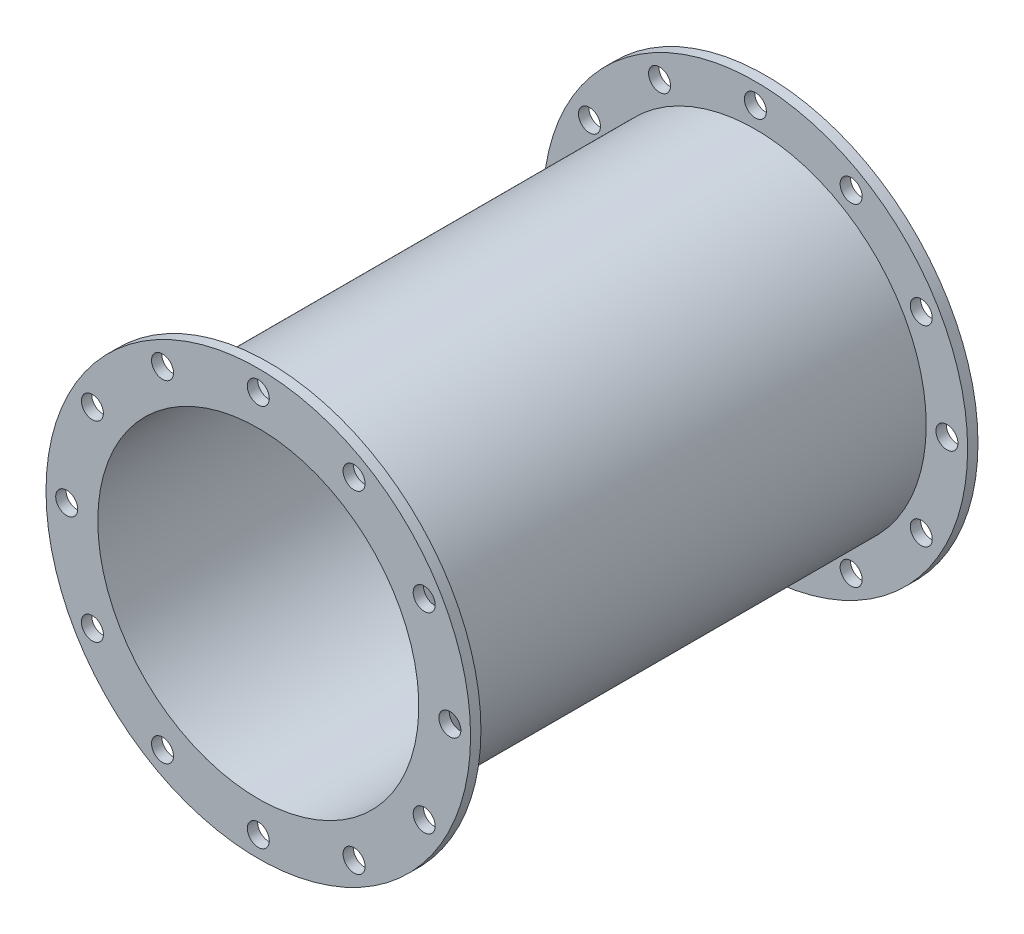
from build123d import *

# Parameters (mm, degrees)
SKETCH2_R               = 104.775
SKETCH2_R_2             = 98.425
BOSS_EXTRUDE1_DEPTH     = 304.8
SKETCH3_R               = 130.175
SKETCH3_R_2             = 104.775
BOSS_EXTRUDE3_DEPTH     = 6.35
F_1_2_CLEARANCE_HOLE1_D = 13.49248
CIRPATTERN1_COUNT       = 12
MIRROR2_COPY_1_D        = 13.49248
MIRROR2_COPY_2_D        = 13.49248
MIRROR2_COPY_3_D        = 13.49248
MIRROR2_COPY_4_D        = 13.49248
MIRROR2_COPY_5_D        = 13.49248
MIRROR2_COPY_6_D        = 13.49248
MIRROR2_COPY_7_D        = 13.49248
MIRROR2_COPY_8_D        = 13.49248
MIRROR2_COPY_9_D        = 13.49248
MIRROR2_COPY_10_D       = 13.49248
MIRROR2_COPY_11_D       = 13.49248


with BuildPart() as part:
    # Sketch2 → Boss-Extrude1 (new body)
    with BuildSketch(Plane.XY):
        with Locations(Location((0, 0, 0), (0, 0, 180))):
            Circle(SKETCH2_R)
        with Locations(Location((0, 0, 0), (0, 0, 180))):
            Circle(SKETCH2_R_2, mode=Mode.SUBTRACT)
    boss_extrude1 = extrude(amount=BOSS_EXTRUDE1_DEPTH)

    # Sketch3 → Boss-Extrude3 (add)
    with BuildSketch(Plane(origin=(0, 0, 0), x_dir=(-1, 0, 0), z_dir=(0, 0, -1))):
        Circle(SKETCH3_R)
        Circle(SKETCH3_R_2, mode=Mode.SUBTRACT)
    boss_extrude3 = extrude(amount=-BOSS_EXTRUDE3_DEPTH)

    # 1/2 Clearance Hole1 (through all)
    with Locations(Plane(origin=(0, 0, 0), x_dir=(-1, 0, 0), z_dir=(0, 0, -1))):
        with Locations((0, 117.475)):
            f_1_2_clearance_hole1 = Hole(F_1_2_CLEARANCE_HOLE1_D / 2)

    # CirPattern1: 1/2 Clearance Hole1 ×12 about axis
    cirpattern1_axis = Axis((0, 0, 0), (0, 0, 1))
    for i in range(1, CIRPATTERN1_COUNT):
        add(f_1_2_clearance_hole1.rotate(cirpattern1_axis, i * 360 / CIRPATTERN1_COUNT), mode=Mode.SUBTRACT)

    # Mirror2: Boss-Extrude1, Boss-Extrude3, 1/2 Clearance Hole1 across plane
    add(boss_extrude1.mirror(Plane.XY.offset(155.575)))
    add(boss_extrude3.mirror(Plane.XY.offset(155.575)))
    add(f_1_2_clearance_hole1.mirror(Plane.XY.offset(155.575)), mode=Mode.SUBTRACT)

    # Mirror2 copy 1 (through all)
    with Locations(Plane(origin=(0, 0, 311.15), x_dir=(-0.8660254037844387, -0.49999999999999994, 0), z_dir=(0, 0, 1))):
        with Locations((0, -117.475)):
            Hole(MIRROR2_COPY_1_D / 2)

    # Mirror2 copy 2 (through all)
    with Locations(Plane(origin=(0, 0, 311.15), x_dir=(-0.5000000000000001, -0.8660254037844386, 0), z_dir=(0, 0, 1))):
        with Locations((0, -117.475)):
            Hole(MIRROR2_COPY_2_D / 2)

    # Mirror2 copy 3 (through all)
    with Locations(Plane(origin=(0, 0, 311.15), x_dir=(0, -1, 0), z_dir=(0, 0, 1))):
        with Locations((0, -117.475)):
            Hole(MIRROR2_COPY_3_D / 2)

    # Mirror2 copy 4 (through all)
    with Locations(Plane(origin=(0, 0, 311.15), x_dir=(0.4999999999999998, -0.8660254037844387, 0), z_dir=(0, 0, 1))):
        with Locations((0, -117.475)):
            Hole(MIRROR2_COPY_4_D / 2)

    # Mirror2 copy 5 (through all)
    with Locations(Plane(origin=(0, 0, 311.15), x_dir=(0.8660254037844387, -0.49999999999999994, 0), z_dir=(0, 0, 1))):
        with Locations((0, -117.475)):
            Hole(MIRROR2_COPY_5_D / 2)

    # Mirror2 copy 6 (through all)
    with Locations(Plane.XY.offset(311.15)):
        with Locations((0, -117.475)):
            Hole(MIRROR2_COPY_6_D / 2)

    # Mirror2 copy 7 (through all)
    with Locations(Plane(origin=(0, 0, 311.15), x_dir=(0.8660254037844386, 0.5000000000000001, 0), z_dir=(0, 0, 1))):
        with Locations((0, -117.475)):
            Hole(MIRROR2_COPY_7_D / 2)

    # Mirror2 copy 8 (through all)
    with Locations(Plane(origin=(0, 0, 311.15), x_dir=(0.5000000000000004, 0.8660254037844384, 0), z_dir=(0, 0, 1))):
        with Locations((0, -117.475)):
            Hole(MIRROR2_COPY_8_D / 2)

    # Mirror2 copy 9 (through all)
    with Locations(Plane(origin=(0, 0, 311.15), x_dir=(0, 1, 0), z_dir=(0, 0, 1))):
        with Locations((0, -117.475)):
            Hole(MIRROR2_COPY_9_D / 2)

    # Mirror2 copy 10 (through all)
    with Locations(Plane(origin=(0, 0, 311.15), x_dir=(-0.5000000000000001, 0.8660254037844386, 0), z_dir=(0, 0, 1))):
        with Locations((0, -117.475)):
            Hole(MIRROR2_COPY_10_D / 2)

    # Mirror2 copy 11 (through all)
    with Locations(Plane(origin=(0, 0, 311.15), x_dir=(-0.8660254037844384, 0.5000000000000004, 0), z_dir=(0, 0, 1))):
        with Locations((0, -117.475)):
            Hole(MIRROR2_COPY_11_D / 2)


solid = part.part
